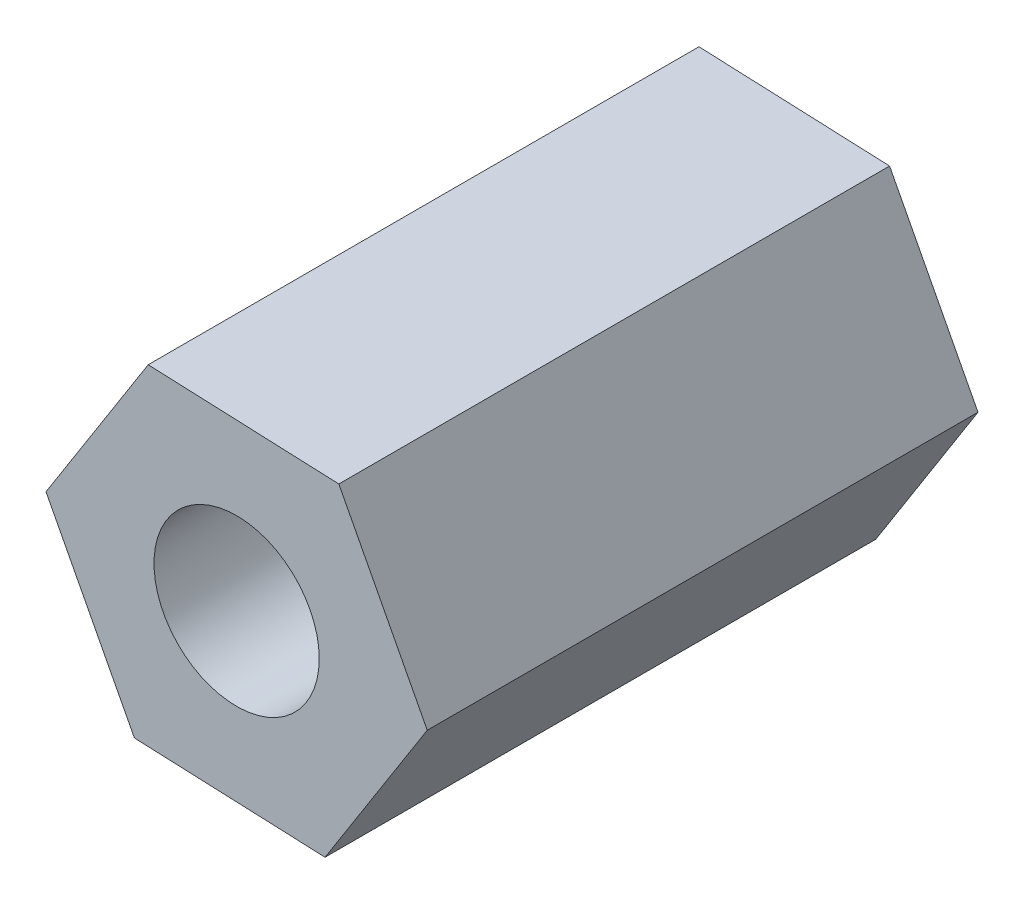
from build123d import *

# Parameters (mm, degrees)
BOSS_EXTRUDE1_DEPTH = 20
SKETCH2_R           = 3
CUT_EXTRUDE1_DEPTH  = 23.036525486


with BuildPart() as part:
    # Sketch1 → Boss-Extrude1 (new body)
    with BuildSketch(Plane.XY):
        Polygon((3.711573676, 5.850147079), (-3.210589149, 6.139390631), (-6.922162824, 0.289243552), (-3.711573676, -5.850147079), (3.210589149, -6.139390631), (6.922162824, -0.289243552), align=None)
    extrude(amount=BOSS_EXTRUDE1_DEPTH)

    # Sketch2 → Cut-Extrude1 (cut, through all)
    with BuildSketch(Plane.XY.offset(20)):
        Circle(SKETCH2_R)
    extrude(amount=-CUT_EXTRUDE1_DEPTH, mode=Mode.SUBTRACT)


solid = part.part
